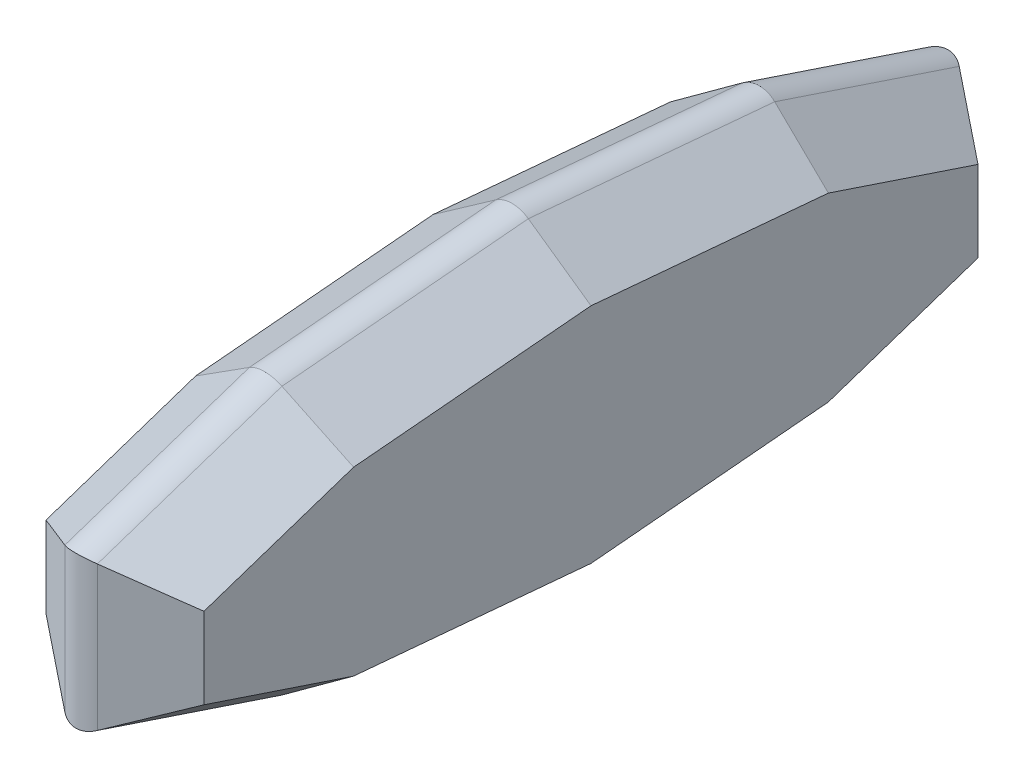
from build123d import *

# Parameters (mm, degrees)
BOSS_EXTRUDE1_DEPTH = 63.5
BOSS_EXTRUDE1_TAPER = 35
BOSS_EXTRUDE2_DEPTH = 63.5
BOSS_EXTRUDE2_TAPER = 35
FILLET1_R           = 22.86


with BuildPart() as part:
    # Sketch2 → Boss-Extrude1 (new body)
    with BuildSketch(Plane(origin=(0, 0, 0), x_dir=(0, 0, -1), z_dir=(1, 0, 0))):
        Polygon((-355.6, -64.578911313), (-199.970092798, -116.552688172), (0, -134.333703051), (199.970092798, -116.552688172), (355.6, -64.578911313), (355.6, 64.578911313), (199.970092798, 116.552688172), (0, 134.333703051), (-199.970092798, 116.552688172), (-355.6, 64.578911313), align=None)
    extrude(amount=BOSS_EXTRUDE1_DEPTH, taper=BOSS_EXTRUDE1_TAPER)

    # Sketch3 → Boss-Extrude2 (add)
    with BuildSketch(Plane.ZY):
        Polygon((0, 134.333703051), (-199.970092798, 116.552688172), (-355.6, 64.578911313), (-355.6, -64.578911313), (-199.970092798, -116.552688172), (0, -134.333703051), (199.970092798, -116.552688172), (355.6, -64.578911313), (355.6, 64.578911313), (199.970092798, 116.552688172), align=None)
    extrude(amount=BOSS_EXTRUDE2_DEPTH, taper=BOSS_EXTRUDE2_TAPER)

    # Fillet1
    fillet1_edges = [part.edges().sort_by_distance(p)[0] for p in [
        (0, 90.565799742, -277.785046399),
        (0, 0, -355.6),
        (0, -90.565799742, -277.785046399),
        (0, -125.443195612, -99.985046399),
        (0, -125.443195612, 99.985046399),
        (0, -90.565799742, 277.785046399),
        (0, 0, 355.6),
        (0, 90.565799742, 277.785046399),
        (0, 125.443195612, 99.985046399),
        (0, 125.443195612, -99.985046399),
    ]]
    fillet(fillet1_edges, radius=FILLET1_R)


solid = part.part
